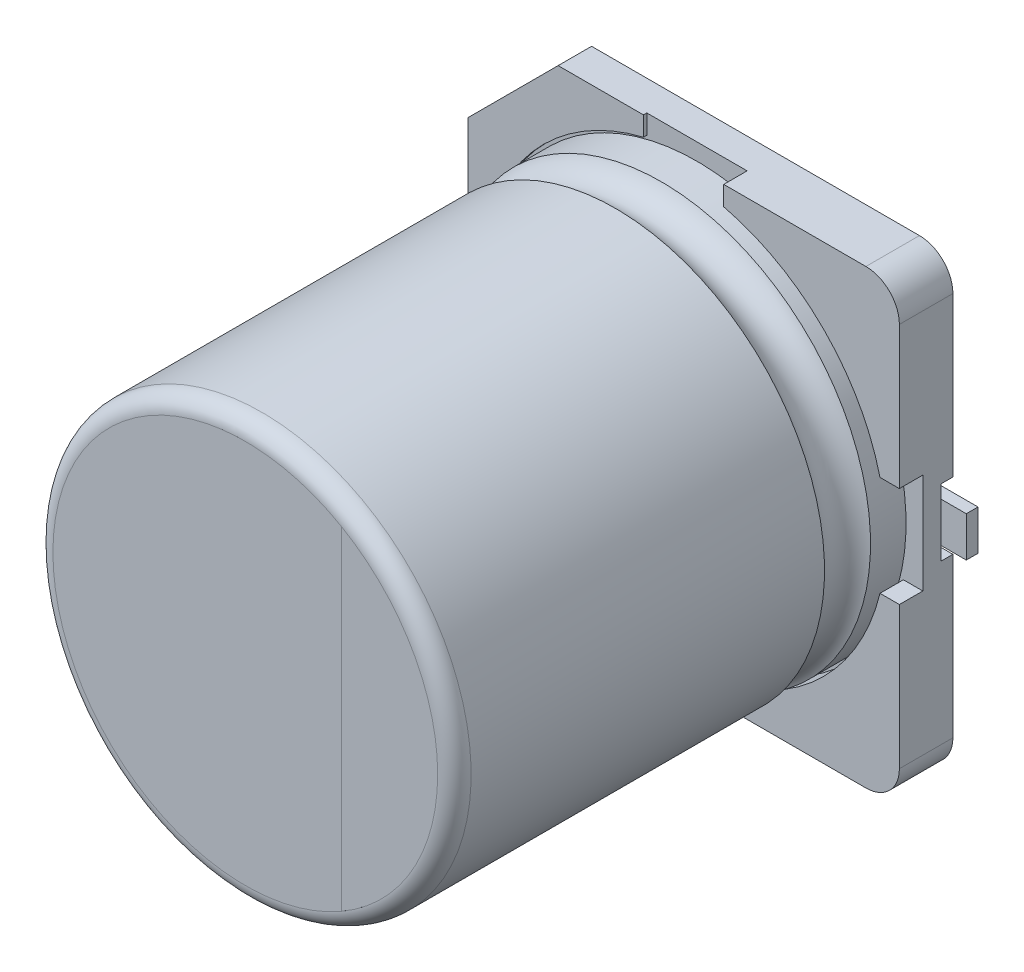
from build123d import *

# Parameters (mm, degrees)
BOSS_EXTRUDE1_DEPTH   = 1.6
CUT_EXTRUDE1_DEPTH    = 0.7
CUT_EXTRUDE2_DEPTH    = 0.6
CUT_EXTRUDE4_DEPTH    = 0.35
FILLET1_R             = 0.5
CUT_EXTRUDE3_DEPTH    = 0.001
BOSS_EXTRUDE2_DEPTH   = 0.35
BOSS_EXTRUDE2_2_DEPTH = 0.35


with BuildPart() as part:
    # Sketch1 → Boss-Extrude1 (new body)
    with BuildSketch(Plane.XY):
        with BuildLine():
            Line((-6.75, 4.05), (-4.05, 6.75))
            Line((-4.05, 6.75), (5.75, 6.75))
            ThreePointArc((5.75, 6.75), (6.457106781, 6.457106781), (6.75, 5.75))
            Line((6.75, 5.75), (6.75, -5.75))
            ThreePointArc((6.75, -5.75), (6.457106781, -6.457106781), (5.75, -6.75))
            Line((5.75, -6.75), (-4.05, -6.75))
            Line((-4.05, -6.75), (-6.75, -4.05))
            Line((-6.75, -4.05), (-6.75, 4.05))
        make_face()
    extrude(amount=BOSS_EXTRUDE1_DEPTH)

    # Sketch2 → Cut-Extrude1 (cut)
    with BuildSketch(Plane.XY.offset(1.6)):
        with BuildLine():
            Line((-1.5, -6.75), (1.5, -6.75))
            Line((1.5, -6.75), (1.5, -6.170291727))
            ThreePointArc((1.5, -6.170291727), (4.490128061, -4.490128061), (6.170291727, -1.5))
            Line((6.170291727, -1.5), (6.75, -1.5))
            Line((6.75, -1.5), (6.75, 1.5))
            Line((6.75, 1.5), (6.170291727, 1.5))
            ThreePointArc((6.170291727, 1.5), (4.490128061, 4.490128061), (1.5, 6.170291727))
            Line((1.5, 6.170291727), (1.5, 6.75))
            Line((1.5, 6.75), (-1.5, 6.75))
            Line((-1.5, 6.75), (-1.5, 6.170291727))
            ThreePointArc((-1.5, 6.170291727), (-4.490128061, 4.490128061), (-6.170291727, 1.5))
            Line((-6.170291727, 1.5), (-6.75, 1.5))
            Line((-6.75, 1.5), (-6.75, -1.5))
            Line((-6.75, -1.5), (-6.170291727, -1.5))
            ThreePointArc((-6.170291727, -1.5), (-4.490128061, -4.490128061), (-1.5, -6.170291727))
            Line((-1.5, -6.170291727), (-1.5, -6.75))
        make_face()
    extrude(amount=-CUT_EXTRUDE1_DEPTH, mode=Mode.SUBTRACT)

    # Sketch3 → Cut-Extrude2 (cut)
    with BuildSketch(Plane.XY.offset(1.6)):
        with BuildLine():
            Line((-4.05, -6.75), (-1.5, -6.75))
            Line((-1.5, -6.75), (-1.5, -6.170291727))
            ThreePointArc((-1.5, -6.170291727), (-4.490128061, -4.490128061), (-6.170291727, -1.5))
            Line((-6.170291727, -1.5), (-6.75, -1.5))
            Line((-6.75, -1.5), (-6.75, -4.05))
            Line((-6.75, -4.05), (-4.05, -6.75))
        make_face()
        with BuildLine():
            Line((-6.75, 4.05), (-6.75, 1.5))
            Line((-6.75, 1.5), (-6.170291727, 1.5))
            ThreePointArc((-6.170291727, 1.5), (-4.490128061, 4.490128061), (-1.5, 6.170291727))
            Line((-1.5, 6.170291727), (-1.5, 6.75))
            Line((-1.5, 6.75), (-4.05, 6.75))
            Line((-4.05, 6.75), (-6.75, 4.05))
        make_face()
    extrude(amount=-CUT_EXTRUDE2_DEPTH, mode=Mode.SUBTRACT)

    # Sketch7 → Cut-Extrude4 (cut)
    with BuildSketch(Plane(origin=(0, 0, 0), x_dir=(-1, 0, 0), z_dir=(0, 0, -1))):
        with BuildLine():
            Line((-2.75, -1), (-6.75, -1))
            Line((-6.75, -1), (-6.75, 1))
            Line((-6.75, 1), (-2.75, 1))
            ThreePointArc((-2.75, 1), (-1.75, 0), (-2.75, -1))
        make_face()
        with BuildLine():
            Line((2.75, -1), (6.75, -1))
            Line((6.75, -1), (6.75, 1))
            Line((6.75, 1), (2.75, 1))
            ThreePointArc((2.75, 1), (1.75, 0), (2.75, -1))
        make_face()
    extrude(amount=-CUT_EXTRUDE4_DEPTH, mode=Mode.SUBTRACT)


with BuildPart() as body_2:
    # Sketch5 → Revolve1 (revolve)
    with BuildSketch(Plane(origin=(0, 0, 0), x_dir=(0, 0, -1), z_dir=(1, 0, 0)), mode=Mode.PRIVATE) as revolve1_sk:
        with BuildLine():
            Line((-0.9, -6.25), (-1.962613646, -6.25))
            ThreePointArc((-1.962613646, -6.25), (-2.65, -5.8), (-3.337386354, -6.25))
            Line((-3.337386354, -6.25), (-14.4, -6.25))
            Line((-14.4, -6.25), (-14.4, 0))
            Line((-14.4, 0), (-0.9, 0))
            Line((-0.9, 0), (-0.9, -6.25))
        make_face()
    revolve(revolve1_sk.sketch.rotate(Axis((0, 0, 0), (0, 0, 1)), 270), axis=Axis((0, 0, 0), (0, 0, 1)))

    # Fillet1
    fillet1_edges = [body_2.edges().sort_by_distance(p)[0] for p in [
        (6.25, 0, 14.4),
    ]]
    fillet(fillet1_edges, radius=FILLET1_R)

    # Sketch6 → Cut-Extrude3 (cut)
    with BuildSketch(Plane.XY.offset(14.4)):
        with BuildLine():
            Line((2.875, 4.979646072), (2.875, -4.979646072))
            ThreePointArc((2.875, -4.979646072), (5.75, 0), (2.875, 4.979646072))
        make_face()
    extrude(amount=-CUT_EXTRUDE3_DEPTH, mode=Mode.SUBTRACT)


with BuildPart() as body_3:
    # Sketch9 → Boss-Extrude2 (new body)
    with BuildSketch(Plane(origin=(0, 0, 0.35), x_dir=(-1, 0, 0), z_dir=(0, 0, -1))):
        with BuildLine():
            Line((7.5, 0.6), (7.5, -0.6))
            Line((7.5, -0.6), (2.75, -0.6))
            ThreePointArc((2.75, -0.6), (2.15, 0), (2.75, 0.6))
            Line((2.75, 0.6), (7.5, 0.6))
        make_face()
    extrude(amount=BOSS_EXTRUDE2_DEPTH)


with BuildPart() as body_4:
    # Sketch9 → Boss-Extrude2 2 (new body)
    with BuildSketch(Plane(origin=(0, 0, 0.35), x_dir=(-1, 0, 0), z_dir=(0, 0, -1))):
        with BuildLine():
            Line((-7.5, 0.6), (-7.5, -0.6))
            Line((-7.5, -0.6), (-2.75, -0.6))
            ThreePointArc((-2.75, -0.6), (-2.15, 0), (-2.75, 0.6))
            Line((-2.75, 0.6), (-7.5, 0.6))
        make_face()
    extrude(amount=BOSS_EXTRUDE2_2_DEPTH)


solid = Compound([part.part, body_2.part, body_3.part, body_4.part])
